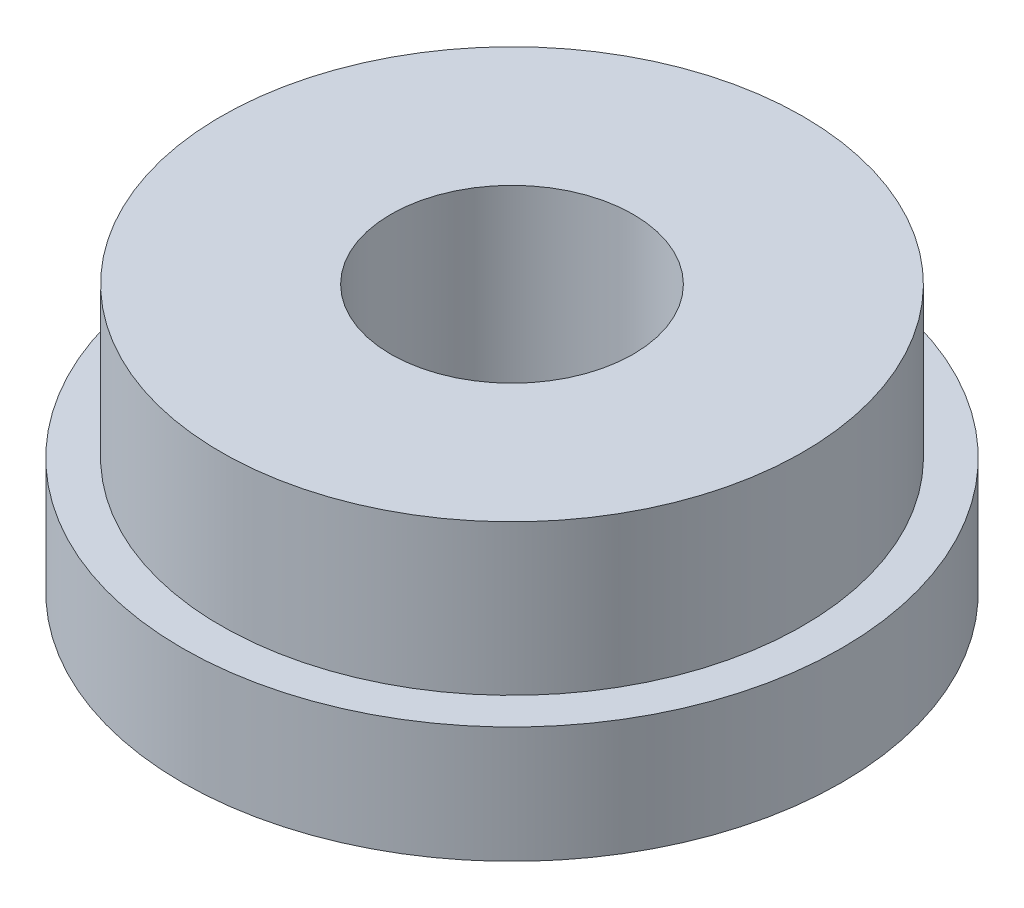
from build123d import *


with BuildPart() as part:
    # ｽｹｯﾁ1 → 回転1 (revolve)
    with BuildSketch(Plane.XY, mode=Mode.PRIVATE) as revolve_1_sk:
        Polygon((1.25, 0), (1.25, 2.75), (3, 2.75), (3, 1.2), (3.4, 1.2), (3.4, 0), align=None)
    revolve(revolve_1_sk.sketch.rotate(Axis((0, 0, 0), (0, 1, 0)), 90), axis=Axis((0, 0, 0), (0, 1, 0)))


solid = part.part
